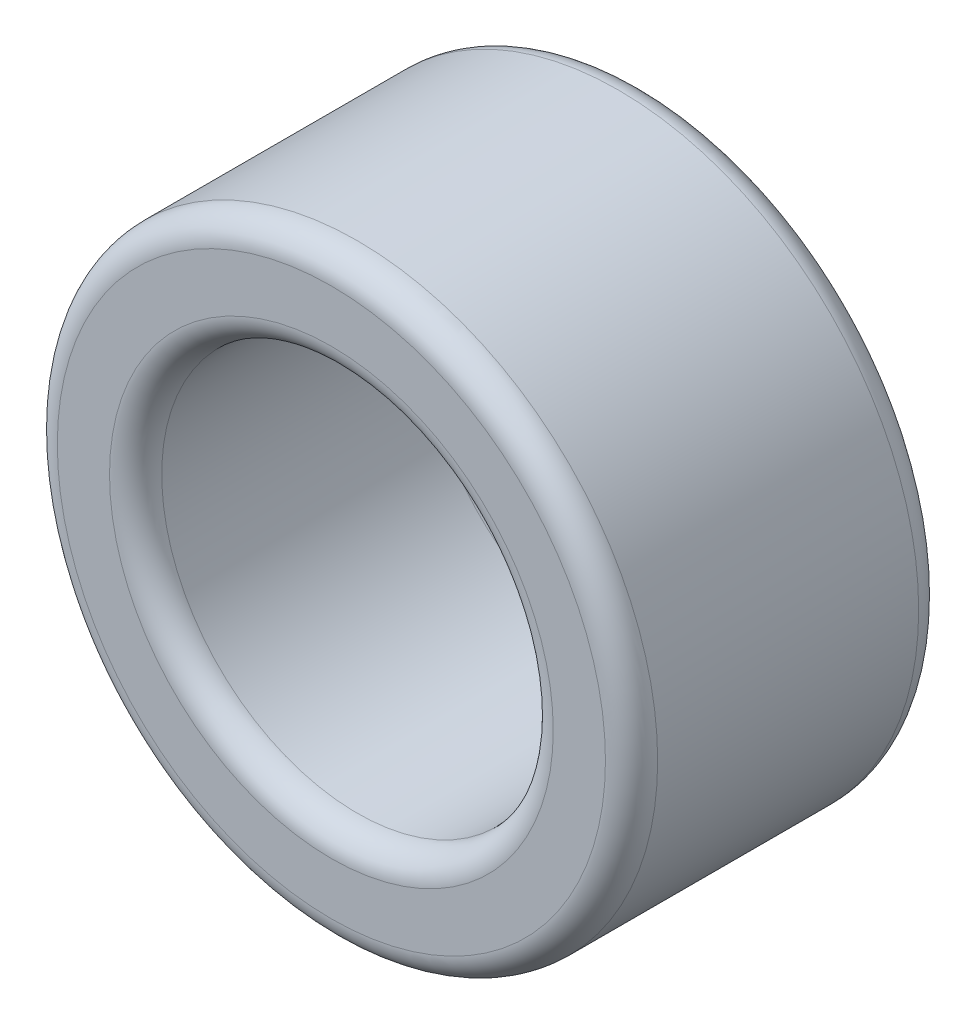
from build123d import *

# Parameters (mm, degrees)
SKETCH1_R           = 1.15
SKETCH1_R_2         = 0.75
BOSS_EXTRUDE1_DEPTH = 1.2
FILLET1_R           = 0.1


with BuildPart() as part:
    # Sketch1 → Boss-Extrude1 (new body)
    with BuildSketch(Plane.XY):
        Circle(SKETCH1_R)
        Circle(SKETCH1_R_2, mode=Mode.SUBTRACT)
    extrude(amount=BOSS_EXTRUDE1_DEPTH)

    # Fillet1
    fillet1_edges = [part.edges().sort_by_distance(p)[0] for p in [
        (-1.15, 0, 0),
        (-1.15, 0, 1.2),
        (-0.75, 0, 0),
        (-0.75, 0, 1.2),
    ]]
    fillet(fillet1_edges, radius=FILLET1_R)


solid = part.part
